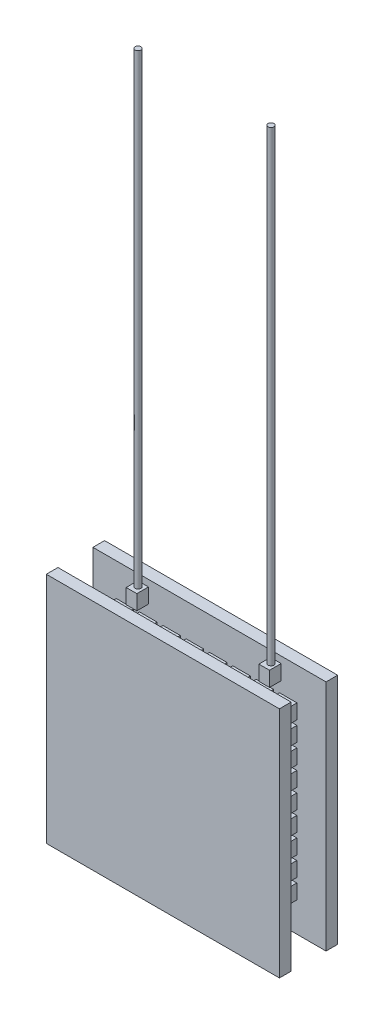
from build123d import *

# Parameters (mm, degrees)
SKETCH3_W           = 0.75
SKETCH3_H           = 0.630584906
SKETCH3_H_2         = 0.630584907
BOSS_EXTRUDE1_DEPTH = 2
SKETCH2_W           = 10
SKETCH2_H           = 10
BOSS_EXTRUDE2_DEPTH = 0.5
SKETCH4_W           = 0.457214239
SKETCH4_H           = 0.640099935
BOSS_EXTRUDE3_DEPTH = 0.5
SKETCH5_R           = 0.125
BOSS_EXTRUDE4_DEPTH = 20


with BuildPart() as part:
    # Sketch3 → Boss-Extrude1 (new body)
    with BuildSketch(Plane.XY):
        with Locations((-3.625, 3.28334582)):
            Rectangle(SKETCH3_W, SKETCH3_H)
        with Locations((-2.624720406, 3.283164409)):
            Rectangle(SKETCH3_W, SKETCH3_H)
        with Locations((-1.624440812, 3.282982998)):
            Rectangle(SKETCH3_W, SKETCH3_H_2)
        with Locations((-0.624161218, 3.282801587)):
            Rectangle(SKETCH3_W, SKETCH3_H_2)
        with Locations((0.376118375, 3.282620175)):
            Rectangle(SKETCH3_W, SKETCH3_H_2)
        with Locations((1.376397969, 3.282438765)):
            Rectangle(SKETCH3_W, SKETCH3_H_2)
        with Locations((2.376677563, 3.282257354)):
            Rectangle(SKETCH3_W, SKETCH3_H_2)
        with Locations((3.376957157, 3.282075942)):
            Rectangle(SKETCH3_W, SKETCH3_H)
        with Locations((-3.625761276, 2.44662842)):
            Rectangle(SKETCH3_W, SKETCH3_H)
        with Locations((-2.625481682, 2.446447009)):
            Rectangle(SKETCH3_W, SKETCH3_H)
        with Locations((-1.625202088, 2.446265598)):
            Rectangle(SKETCH3_W, SKETCH3_H)
        with Locations((-0.624922495, 2.446084187)):
            Rectangle(SKETCH3_W, SKETCH3_H)
        with Locations((0.375357099, 2.445902776)):
            Rectangle(SKETCH3_W, SKETCH3_H_2)
        with Locations((1.375636693, 2.445721365)):
            Rectangle(SKETCH3_W, SKETCH3_H_2)
        with Locations((2.375916287, 2.445539953)):
            Rectangle(SKETCH3_W, SKETCH3_H_2)
        with Locations((3.376195881, 2.445358543)):
            Rectangle(SKETCH3_W, SKETCH3_H_2)
        with Locations((-3.626522552, 1.609911021)):
            Rectangle(SKETCH3_W, SKETCH3_H_2)
        with Locations((-2.626242958, 1.609729609)):
            Rectangle(SKETCH3_W, SKETCH3_H)
        with Locations((-1.625963365, 1.609548198)):
            Rectangle(SKETCH3_W, SKETCH3_H)
        with Locations((-0.625683771, 1.609366787)):
            Rectangle(SKETCH3_W, SKETCH3_H)
        with Locations((0.374595823, 1.609185376)):
            Rectangle(SKETCH3_W, SKETCH3_H)
        with Locations((1.374875417, 1.609003965)):
            Rectangle(SKETCH3_W, SKETCH3_H_2)
        with Locations((2.375155011, 1.608822554)):
            Rectangle(SKETCH3_W, SKETCH3_H_2)
        with Locations((3.375434605, 1.608641143)):
            Rectangle(SKETCH3_W, SKETCH3_H_2)
        with Locations((-3.627283828, 0.773193621)):
            Rectangle(SKETCH3_W, SKETCH3_H_2)
        with Locations((-2.627004235, 0.77301221)):
            Rectangle(SKETCH3_W, SKETCH3_H_2)
        with Locations((-1.626724641, 0.772830799)):
            Rectangle(SKETCH3_W, SKETCH3_H_2)
        with Locations((-0.626445047, 0.772649387)):
            Rectangle(SKETCH3_W, SKETCH3_H)
        with Locations((0.373834547, 0.772467976)):
            Rectangle(SKETCH3_W, SKETCH3_H)
        with Locations((1.374114141, 0.772286565)):
            Rectangle(SKETCH3_W, SKETCH3_H)
        with Locations((2.374393735, 0.772105154)):
            Rectangle(SKETCH3_W, SKETCH3_H)
        with Locations((3.374673329, 0.771923743)):
            Rectangle(SKETCH3_W, SKETCH3_H_2)
        with Locations((-3.628045105, -0.063523779)):
            Rectangle(SKETCH3_W, SKETCH3_H_2)
        with Locations((-2.627765511, -0.063705191)):
            Rectangle(SKETCH3_W, SKETCH3_H_2)
        with Locations((-1.627485917, -0.063886602)):
            Rectangle(SKETCH3_W, SKETCH3_H_2)
        with Locations((-0.627206323, -0.064068012)):
            Rectangle(SKETCH3_W, SKETCH3_H_2)
        with Locations((0.373073271, -0.064249424)):
            Rectangle(SKETCH3_W, SKETCH3_H_2)
        with Locations((1.373352865, -0.064430835)):
            Rectangle(SKETCH3_W, SKETCH3_H)
        with Locations((2.373632459, -0.064612246)):
            Rectangle(SKETCH3_W, SKETCH3_H)
        with Locations((3.373912052, -0.064793657)):
            Rectangle(SKETCH3_W, SKETCH3_H)
        with Locations((-3.628806381, -0.900241179)):
            Rectangle(SKETCH3_W, SKETCH3_H)
        with Locations((-2.628526787, -0.90042259)):
            Rectangle(SKETCH3_W, SKETCH3_H)
        with Locations((-1.628247193, -0.900604002)):
            Rectangle(SKETCH3_W, SKETCH3_H_2)
        with Locations((-0.627967599, -0.900785413)):
            Rectangle(SKETCH3_W, SKETCH3_H_2)
        with Locations((0.372311995, -0.900966824)):
            Rectangle(SKETCH3_W, SKETCH3_H_2)
        with Locations((1.372591589, -0.901148235)):
            Rectangle(SKETCH3_W, SKETCH3_H_2)
        with Locations((2.372871182, -0.901329646)):
            Rectangle(SKETCH3_W, SKETCH3_H_2)
        with Locations((3.373150776, -0.901511057)):
            Rectangle(SKETCH3_W, SKETCH3_H)
        with Locations((-3.629567657, -1.736958579)):
            Rectangle(SKETCH3_W, SKETCH3_H)
        with Locations((-2.629288063, -1.73713999)):
            Rectangle(SKETCH3_W, SKETCH3_H)
        with Locations((-1.629008469, -1.737321401)):
            Rectangle(SKETCH3_W, SKETCH3_H)
        with Locations((-0.628728875, -1.737502813)):
            Rectangle(SKETCH3_W, SKETCH3_H_2)
        with Locations((0.371550719, -1.737684224)):
            Rectangle(SKETCH3_W, SKETCH3_H_2)
        with Locations((1.371830312, -1.737865635)):
            Rectangle(SKETCH3_W, SKETCH3_H_2)
        with Locations((2.372109906, -1.738047046)):
            Rectangle(SKETCH3_W, SKETCH3_H_2)
        with Locations((3.3723895, -1.738228456)):
            Rectangle(SKETCH3_W, SKETCH3_H_2)
        with Locations((-3.630328933, -2.573675978)):
            Rectangle(SKETCH3_W, SKETCH3_H_2)
        with Locations((-2.630049339, -2.57385739)):
            Rectangle(SKETCH3_W, SKETCH3_H)
        with Locations((-1.629769745, -2.574038801)):
            Rectangle(SKETCH3_W, SKETCH3_H)
        with Locations((-0.629490151, -2.574220212)):
            Rectangle(SKETCH3_W, SKETCH3_H)
        with Locations((0.370789442, -2.574401623)):
            Rectangle(SKETCH3_W, SKETCH3_H)
        with Locations((1.371069036, -2.574583035)):
            Rectangle(SKETCH3_W, SKETCH3_H_2)
        with Locations((2.37134863, -2.574764446)):
            Rectangle(SKETCH3_W, SKETCH3_H_2)
        with Locations((3.371628224, -2.574945857)):
            Rectangle(SKETCH3_W, SKETCH3_H_2)
        with Locations((-3.631090209, -3.410393379)):
            Rectangle(SKETCH3_W, SKETCH3_H_2)
        with Locations((-2.630810615, -3.41057479)):
            Rectangle(SKETCH3_W, SKETCH3_H_2)
        with Locations((-1.630531021, -3.410756201)):
            Rectangle(SKETCH3_W, SKETCH3_H_2)
        with Locations((-0.630251428, -3.410937612)):
            Rectangle(SKETCH3_W, SKETCH3_H)
        with Locations((0.370028166, -3.411119023)):
            Rectangle(SKETCH3_W, SKETCH3_H)
        with Locations((1.37030776, -3.411300434)):
            Rectangle(SKETCH3_W, SKETCH3_H)
        with Locations((2.370587354, -3.411481845)):
            Rectangle(SKETCH3_W, SKETCH3_H)
        with Locations((3.370866948, -3.411663257)):
            Rectangle(SKETCH3_W, SKETCH3_H_2)
    extrude(amount=BOSS_EXTRUDE1_DEPTH)

    # Sketch2 → Boss-Extrude2 (add)
    with BuildSketch(Plane.XY):
        Rectangle(SKETCH2_W, SKETCH2_H)
    boss_extrude2 = extrude(amount=-BOSS_EXTRUDE2_DEPTH)

    # Mirror1: Boss-Extrude2 across plane
    add(boss_extrude2.mirror(Plane(origin=(0, 0, 0.75), x_dir=(1, 0, 0), z_dir=(0, 0, -1))))

    # Sketch4 → Boss-Extrude3 (add)
    with BuildSketch(Plane.XY):
        with Locations((-2.846158639, 4.400687052)):
            Rectangle(SKETCH4_W, SKETCH4_H)
    boss_extrude3 = extrude(amount=BOSS_EXTRUDE3_DEPTH)

    # Mirror2: Boss-Extrude3 across plane
    add(boss_extrude3.mirror(Plane.ZY))

    # Sketch5 → Boss-Extrude4 (add)
    with BuildSketch(Plane(origin=(0, 4.720737019, 0), x_dir=(1, 0, 0), z_dir=(0, 1, 0))):
        with Locations(Location((2.856423303, -0.216950836, 0), (0, 0, 180))):
            Circle(SKETCH5_R)
        with Locations(Location((-2.846594036, -0.216950836, 0), (0, 0, 90))):
            Circle(SKETCH5_R)
    extrude(amount=BOSS_EXTRUDE4_DEPTH)


solid = part.part
